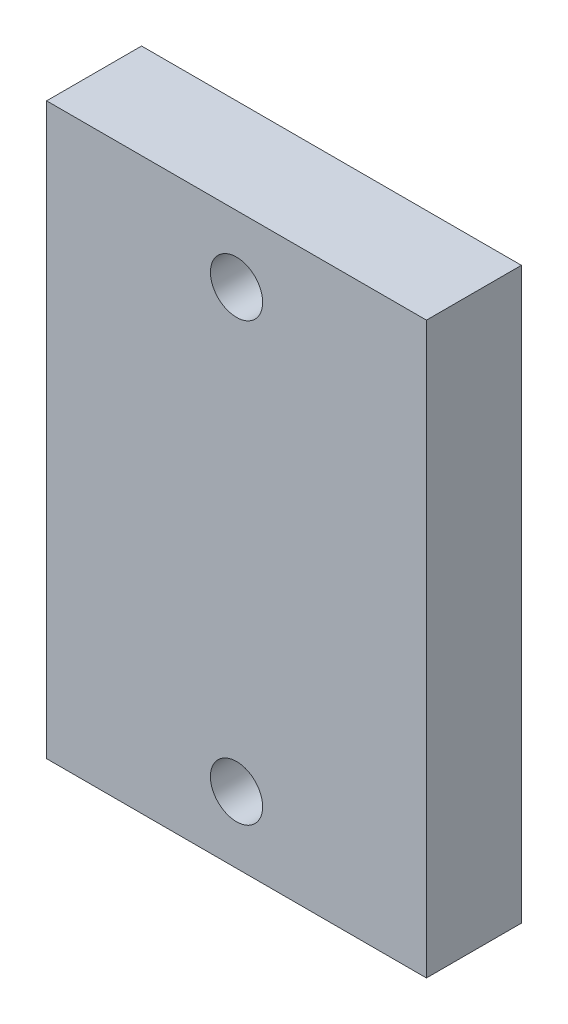
from build123d import *

# Parameters (mm, degrees)
SKETCH_1_W          = 40
SKETCH_1_H          = 60
EXTRUDE_1_DEPTH     = 10
SKETCH_2_R          = 2.75
CUT_EXTRUDE_1_DEPTH = 10


with BuildPart() as part:
    # 草图1 → 凸台-拉伸1 (new body)
    with BuildSketch(Plane.XY):
        Rectangle(SKETCH_1_W, SKETCH_1_H)
    extrude(amount=EXTRUDE_1_DEPTH)

    # 草图2 → 切除-拉伸1 (cut)
    with BuildSketch(Plane.XY.offset(10)):
        with Locations((0, -23)):
            Circle(SKETCH_2_R)
        with Locations((0, 23)):
            Circle(SKETCH_2_R)
    extrude(amount=-CUT_EXTRUDE_1_DEPTH, mode=Mode.SUBTRACT)


solid = part.part
